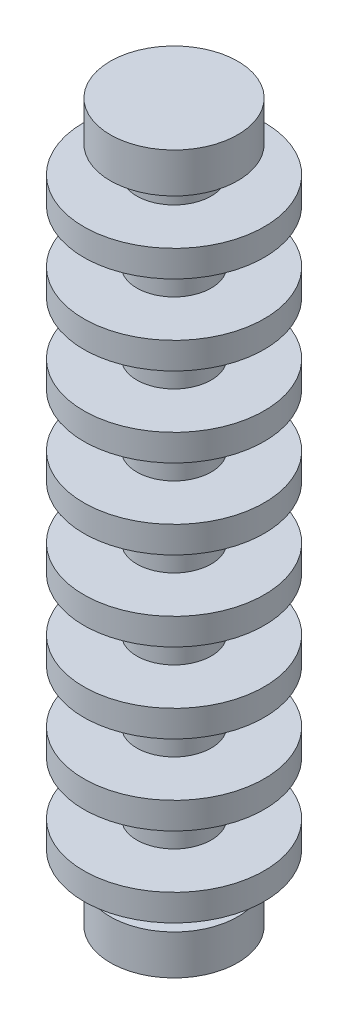
from build123d import *


with BuildPart() as part:
    # Sketch1 → Revolve1 (revolve)
    with BuildSketch(Plane.XY, mode=Mode.PRIVATE) as revolve1_sk:
        Polygon((2.8, 24), (2.8, 22), (6.8, 22), (6.8, 20), (2.8, 20), (2.8, 18), (2.8, 16), (6.8, 16), (6.8, 14), (2.8, 14), (2.8, 12), (2.8, 10), (6.8, 10), (6.8, 8), (2.8, 8), (2.8, 6), (2.8, 4), (6.8, 4), (6.8, 2), (2.8, 2), (2.8, 0), (2.8, -2), (6.8, -2), (6.8, -4), (2.8, -4), (2.8, -6), (2.8, -8), (6.8, -8), (6.8, -10), (2.8, -10), (2.8, -12), (2.8, -14), (6.8, -14), (6.8, -16), (2.8, -16), (2.8, -18), (2.8, -20), (6.8, -20), (6.8, -22), (2.8, -22), (2.8, -24), (4.8, -24), (4.8, -27), (0, -27), (0, 27), (4.8, 27), (4.8, 24), align=None)
    revolve(revolve1_sk.sketch.rotate(Axis((0, 27, 0), (0, -1, 0)), 180), axis=Axis((0, 27, 0), (0, -1, 0)))


solid = part.part
